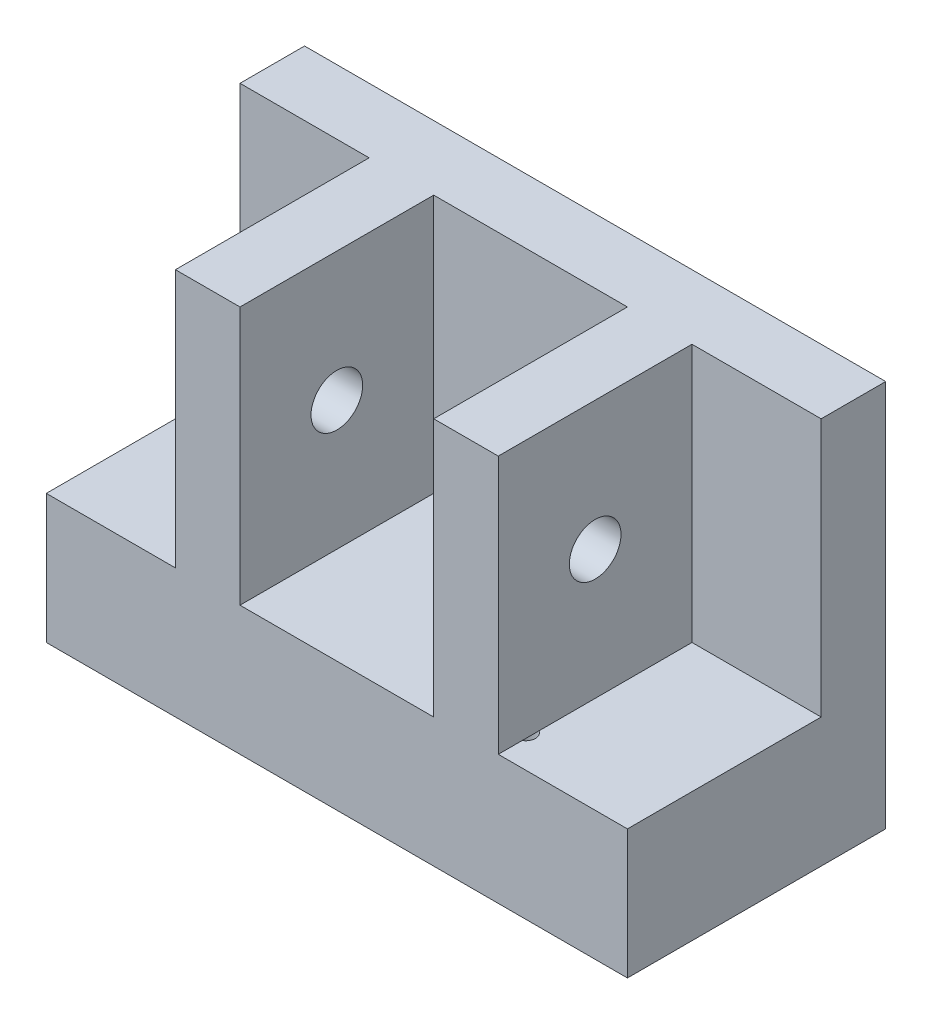
from build123d import *

# Parameters (mm, degrees)
SKETCH3_W               = 20
SKETCH3_H               = 10
BOSS_EXTRUDE1_DEPTH     = 40
CUT_EXTRUDE1_DEPTH      = 83.462112512
CUT_EXTRUDE1_DEPTH_BACK = 83.462112512
SKETCH4_R               = 4
SKETCH7_W               = 90
SKETCH7_H               = 40
BOSS_EXTRUDE3_DEPTH     = 20
SKETCH8_R               = 1.5
CUT_EXTRUDE3_DEPTH      = 20


with BuildPart() as part:
    # Sketch3 → Boss-Extrude1 (new body)
    with BuildSketch(Plane(origin=(0, 0, 0), x_dir=(1, 0, 0), z_dir=(0, 1, 0))):
        with Locations((-35, 35)):
            Rectangle(SKETCH3_W, SKETCH3_H)
        Polygon((-25, 30), (-25, 0), (-15, 0), (-15, 30), (0, 30), (0, 40), (-25, 40), align=None)
        Polygon((0, 40), (0, 30), (15, 30), (15, 0), (25, 0), (25, 30), (25, 40), align=None)
        with Locations((35, 35)):
            Rectangle(SKETCH3_W, SKETCH3_H)
    extrude(amount=BOSS_EXTRUDE1_DEPTH)

    # Sketch4 → Cut-Extrude1 (cut, two sides: drawn at the far end of the back side and taken through both)
    with BuildSketch(Plane(origin=(-15, 0, 0), x_dir=(0, 0, -1), z_dir=(1, 0, 0)).offset(-CUT_EXTRUDE1_DEPTH_BACK)):
        with Locations((15, 20)):
            Circle(SKETCH4_R)
    extrude(amount=CUT_EXTRUDE1_DEPTH + CUT_EXTRUDE1_DEPTH_BACK, mode=Mode.SUBTRACT)

    # Sketch7 → Boss-Extrude3 (add)
    with BuildSketch(Plane.XZ):
        with Locations((0, -20)):
            Rectangle(SKETCH7_W, SKETCH7_H)
    extrude(amount=BOSS_EXTRUDE3_DEPTH)

    # Sketch8 → Cut-Extrude3 (cut)
    with BuildSketch(Plane.XZ.offset(20)):
        with Locations(Location((-24.25, -5, 0), (0, 0, 270))):
            Circle(SKETCH8_R)
        with Locations(Location((24.25, -5, 0), (0, 0, 270))):
            Circle(SKETCH8_R)
    extrude(amount=-CUT_EXTRUDE3_DEPTH, mode=Mode.SUBTRACT)


solid = part.part
